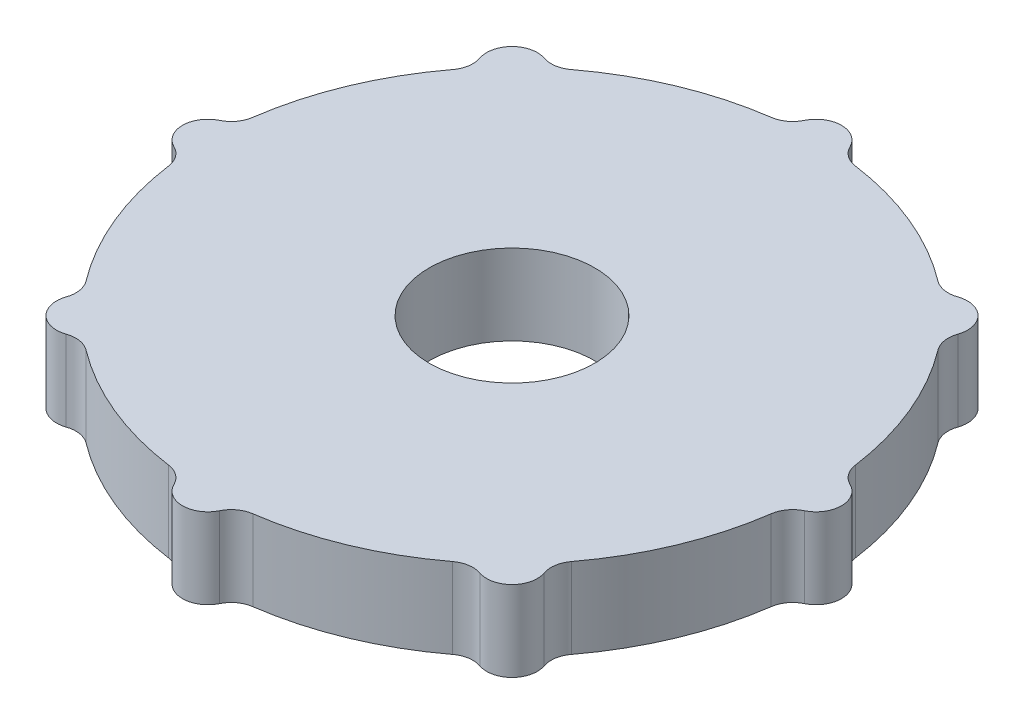
from build123d import *

# Parameters (mm, degrees)
SKETCH2_R           = 3.2639
BOSS_EXTRUDE1_DEPTH = 3.175
BOSS_EXTRUDE2_DEPTH = 3.175
CIRPATTERN1_COUNT   = 8


with BuildPart() as part:
    # Sketch2 → Boss-Extrude1 (new body)
    with BuildSketch(Plane(origin=(0, 0, 0), x_dir=(-1, 0, 0), z_dir=(0, 1, 0))):
        with BuildLine():
            ThreePointArc((-1.660095527, 11.884615385), (-7.876511083, -9.053207894), (12, 0))
            ThreePointArc((12, 0), (9.053207894, 7.876511083), (1.660095527, 11.884615385))
            ThreePointArc((1.660095527, 11.884615385), (0, 12), (-1.660095527, 11.884615385))
        make_face()
        Circle(SKETCH2_R, mode=Mode.SUBTRACT)
    extrude(amount=BOSS_EXTRUDE1_DEPTH)

    # Sketch2<3> → Boss-Extrude2 (add)
    with BuildSketch(Plane(origin=(0, 0, 0), x_dir=(-1, 0, 0), z_dir=(0, 1, 0))):
        with BuildLine():
            ThreePointArc((-1.660095527, 11.884615385), (0, 12), (1.660095527, 11.884615385))
            ThreePointArc((1.660095527, 11.884615385), (1.210599357, 12.066020943), (0.899218411, 12.4375))
            ThreePointArc((0.899218411, 12.4375), (0, 13), (-0.899218411, 12.4375))
            ThreePointArc((-0.899218411, 12.4375), (-1.210599357, 12.066020943), (-1.660095527, 11.884615385))
        make_face()
    boss_extrude2 = extrude(amount=BOSS_EXTRUDE2_DEPTH)

    # CirPattern1: Boss-Extrude2 ×8 about axis
    cirpattern1_axis = Axis((0, 3.175, 0), (0, -1, 0))
    for i in range(1, CIRPATTERN1_COUNT):
        add(boss_extrude2.rotate(cirpattern1_axis, i * 360 / CIRPATTERN1_COUNT))


solid = part.part
